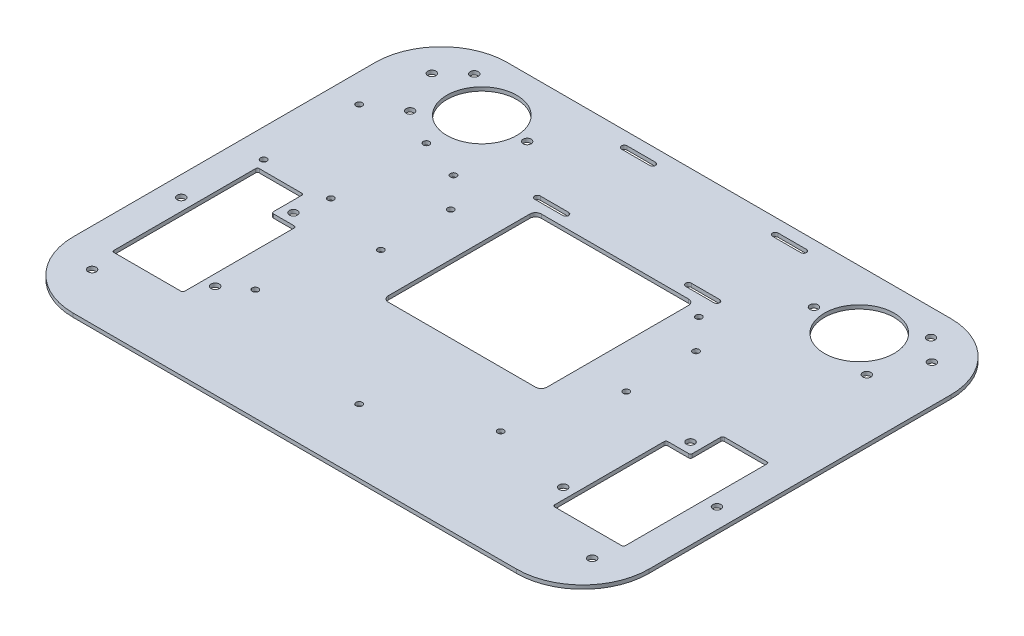
from build123d import *

# Parameters (mm, degrees)
BOSS_EXTRUDE1_DEPTH  = 2
CUT_EXTRUDE8_DEPTH   = 192.01112533
SKETCH3_R            = 2.15
CUT_EXTRUDE9_DEPTH   = 192.01112533
SKETCH8_R            = 2.15
CUT_EXTRUDE11_DEPTH  = 192.01112533
FILLET1_R            = 1
SKETCH17_R           = 18.5
SKETCH17_R_2         = 2.15
CUT_EXTRUDE19_DEPTH  = 10
SKETCH19_R           = 1.65
SKETCH19_W           = 84
SKETCH19_H           = 81
CUT_EXTRUDE21_DEPTH  = 192.01112533
FILLET2_R            = 3
SKETCH20_R           = 1.65
CUT_EXTRUDE22_DEPTH  = 192.01112533
SKETCH21_R           = 1.65
CUT_EXTRUDE23_DEPTH  = 192.01112533
CUT_EXTRUDE24_DEPTH  = 192.01112533
FILLET1_OF_MIRROR1_R = 1


with BuildPart() as part:
    # Sketch1 → Boss-Extrude1 (new body)
    with BuildSketch(Plane(origin=(0, 0, 0), x_dir=(1, 0, 0), z_dir=(0, 1, 0))):
        with BuildLine():
            Line((117.5, -115), (-117.5, -115))
            ThreePointArc((-117.5, -115), (-142.248737342, -104.748737342), (-152.5, -80))
            Line((-152.5, -80), (-152.5, 80))
            ThreePointArc((-152.5, 80), (-142.248737342, 104.748737342), (-117.5, 115))
            Line((-117.5, 115), (117.5, 115))
            ThreePointArc((117.5, 115), (142.248737342, 104.748737342), (152.5, 80))
            Line((152.5, 80), (152.5, -80))
            ThreePointArc((152.5, -80), (142.248737342, -104.748737342), (117.5, -115))
        make_face()
    extrude(amount=-BOSS_EXTRUDE1_DEPTH)

    # Sketch2 → Cut-Extrude8 (cut, through all)
    with BuildSketch(Plane(origin=(0, 0, 0), x_dir=(1, 0, 0), z_dir=(0, 1, 0))):
        Polygon((98, -76.4), (98, -16.4), (111, -16.4), (111, 0.6), (135.5, 0.6), (135.5, -76.4), align=None)
    cut_extrude8 = extrude(amount=-CUT_EXTRUDE8_DEPTH, mode=Mode.SUBTRACT)

    # Sketch3 → Cut-Extrude9 (cut, through all)
    with BuildSketch(Plane(origin=(0, 0, 0), x_dir=(1, 0, 0), z_dir=(0, 1, 0))):
        with Locations(Location((92.2, -65.070175326, 0), (0, 0, 270))):
            Circle(SKETCH3_R)
        with Locations(Location((105.2, -10.6, 0), (0, 0, 270))):
            Circle(SKETCH3_R)
        with Locations(Location((141.935832446, -33.3314455, 0), (0, 0, 270))):
            Circle(SKETCH3_R)
    cut_extrude9 = extrude(amount=-CUT_EXTRUDE9_DEPTH, mode=Mode.SUBTRACT)

    # Sketch8 → Cut-Extrude11 (cut, through all)
    with BuildSketch(Plane(origin=(0, 0, 0), x_dir=(1, 0, 0), z_dir=(0, 1, 0))):
        with Locations(Location((-132.5, 90, 0), (0, 0, 270))):
            Circle(SKETCH8_R)
        with Locations(Location((132.5, 90, 0), (0, 0, 270))):
            Circle(SKETCH8_R)
        with Locations(Location((-132.5, -90, 0), (0, 0, 270))):
            Circle(SKETCH8_R)
        with Locations(Location((132.5, -90, 0), (0, 0, 270))):
            Circle(SKETCH8_R)
    extrude(amount=-CUT_EXTRUDE11_DEPTH, mode=Mode.SUBTRACT)

    # Fillet1
    fillet1_edges = [part.edges().sort_by_distance(p)[0] for p in [
        (135.5, -1, 76.4),
        (98, -1, 76.4),
        (98, -1, 16.4),
        (111, -1, 16.4),
        (111, -1, -0.6),
        (135.5, -1, -0.6),
    ]]
    fillet(fillet1_edges, radius=FILLET1_R)

    # Sketch17 → Cut-Extrude19 (cut)
    with BuildSketch(Plane(origin=(0, 0, 0), x_dir=(1, 0, 0), z_dir=(0, 1, 0))):
        with Locations(Location((100, 84, 0), (0, 0, 270))):
            Circle(SKETCH17_R)
        with Locations(Location((121, 101, 0), (0, 0, 270))):
            Circle(SKETCH17_R_2)
        with Locations(Location((121, 67, 0), (0, 0, 270))):
            Circle(SKETCH17_R_2)
        with Locations(Location((76, 84, 0), (0, 0, 270))):
            Circle(SKETCH17_R_2)
    cut_extrude19 = extrude(amount=-CUT_EXTRUDE19_DEPTH, mode=Mode.SUBTRACT)

    # Sketch19 → Cut-Extrude21 (cut, through all)
    with BuildSketch(Plane(origin=(0, 0, 0), x_dir=(1, 0, 0), z_dir=(0, 1, 0))):
        with Locations(Location((-65, 32.5, 0), (0, 0, 270))):
            Circle(SKETCH19_R)
        with Locations(Location((-65, -4.5, 0), (0, 0, 270))):
            Circle(SKETCH19_R)
        with Locations(Location((65, -4.5, 0), (0, 0, 270))):
            Circle(SKETCH19_R)
        with Locations(Location((65, 32.5, 0), (0, 0, 270))):
            Circle(SKETCH19_R)
        with Locations((0, 14)):
            Rectangle(SKETCH19_W, SKETCH19_H)
    extrude(amount=-CUT_EXTRUDE21_DEPTH, mode=Mode.SUBTRACT)

    # Fillet2
    fillet2_edges = [part.edges().sort_by_distance(p)[0] for p in [
        (42, -1, -54.5),
        (42, -1, 26.5),
        (-42, -1, 26.5),
        (-42, -1, -54.5),
    ]]
    fillet(fillet2_edges, radius=FILLET2_R)

    # Sketch20 → Cut-Extrude22 (cut, through all)
    with BuildSketch(Plane(origin=(0, 0, 0), x_dir=(1, 0, 0), z_dir=(0, 1, 0))):
        with Locations(Location((-137.5, 56.5, 0), (0, 0, 270))):
            Circle(SKETCH20_R)
        with Locations(Location((-101.9, 56.5, 0), (0, 0, 270))):
            Circle(SKETCH20_R)
        with Locations(Location((-137.5, 5.9, 0), (0, 0, 270))):
            Circle(SKETCH20_R)
        with Locations(Location((-101.9, 5.9, 0), (0, 0, 270))):
            Circle(SKETCH20_R)
    extrude(amount=-CUT_EXTRUDE22_DEPTH, mode=Mode.SUBTRACT)

    # Sketch21 → Cut-Extrude23 (cut, through all)
    with BuildSketch(Plane(origin=(0, 0, 0), x_dir=(1, 0, 0), z_dir=(0, 1, 0))):
        with Locations(Location((-80, 49, 0), (0, 0, 270))):
            Circle(SKETCH21_R)
        with Locations(Location((-80, -56, 0), (0, 0, 270))):
            Circle(SKETCH21_R)
        with Locations(Location((0, -81, 0), (0, 0, 270))):
            Circle(SKETCH21_R)
        with Locations(Location((50, -56, 0), (0, 0, 270))):
            Circle(SKETCH21_R)
        with Locations(Location((50, 49, 0), (0, 0, 270))):
            Circle(SKETCH21_R)
    extrude(amount=-CUT_EXTRUDE23_DEPTH, mode=Mode.SUBTRACT)

    # Sketch23 → Cut-Extrude24 (cut, through all)
    with BuildSketch(Plane(origin=(0, 0, 0), x_dir=(1, 0, 0), z_dir=(0, 1, 0))):
        with BuildLine():
            Line((32.5, 105.5), (47.5, 105.5))
            ThreePointArc((47.5, 105.5), (49, 107), (47.5, 108.5))
            Line((47.5, 108.5), (32.5, 108.5))
            ThreePointArc((32.5, 108.5), (31, 107), (32.5, 105.5))
        make_face()
        with BuildLine():
            Line((32.5, 62.5), (47.5, 62.5))
            ThreePointArc((47.5, 62.5), (49, 61), (47.5, 59.5))
            Line((47.5, 59.5), (32.5, 59.5))
            ThreePointArc((32.5, 59.5), (31, 61), (32.5, 62.5))
        make_face()
    cut_extrude24 = extrude(amount=-CUT_EXTRUDE24_DEPTH, mode=Mode.SUBTRACT)

    # Mirror1: Cut-Extrude8, Cut-Extrude9, Cut-Extrude19, Cut-Extrude24 across plane
    add(cut_extrude8.mirror(Plane(origin=(0, 0, 0), x_dir=(0, 0, 1), z_dir=(1, 0, 0))), mode=Mode.SUBTRACT)
    add(cut_extrude9.mirror(Plane(origin=(0, 0, 0), x_dir=(0, 0, 1), z_dir=(1, 0, 0))), mode=Mode.SUBTRACT)
    add(cut_extrude19.mirror(Plane(origin=(0, 0, 0), x_dir=(0, 0, 1), z_dir=(1, 0, 0))), mode=Mode.SUBTRACT)
    add(cut_extrude24.mirror(Plane(origin=(0, 0, 0), x_dir=(0, 0, 1), z_dir=(1, 0, 0))), mode=Mode.SUBTRACT)

    # Fillet1 of Mirror1
    fillet1_of_mirror1_edges = [part.edges().sort_by_distance(p)[0] for p in [
        (-135.5, -1, 76.4),
        (-98, -1, 76.4),
        (-98, -1, 16.4),
        (-111, -1, 16.4),
        (-111, -1, -0.6),
        (-135.5, -1, -0.6),
    ]]
    fillet(fillet1_of_mirror1_edges, radius=FILLET1_OF_MIRROR1_R)


solid = part.part
